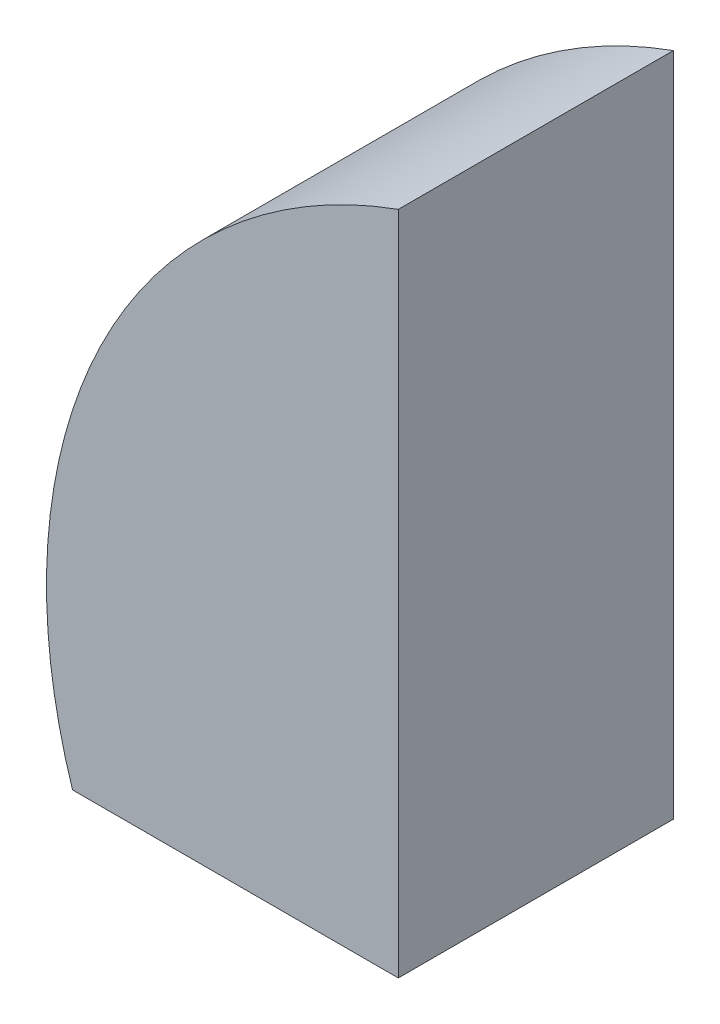
from build123d import *

# Parameters (mm, degrees)
BOSS_EXTRUDE1_DEPTH = 965.2


with BuildPart() as part:
    # Sketch1 → Boss-Extrude1 (new body)
    with BuildSketch(Plane.XY):
        with BuildLine():
            ThreePointArc((-635, 1758.289200786), (-1679.177145497, 821.68730527), (-1778, -577.513561399))
            Line((-1778, -577.513561399), (-635, -577.513561399))
            Line((-635, -577.513561399), (-635, 1758.289200786))
        make_face()
    extrude(amount=BOSS_EXTRUDE1_DEPTH)


solid = part.part
